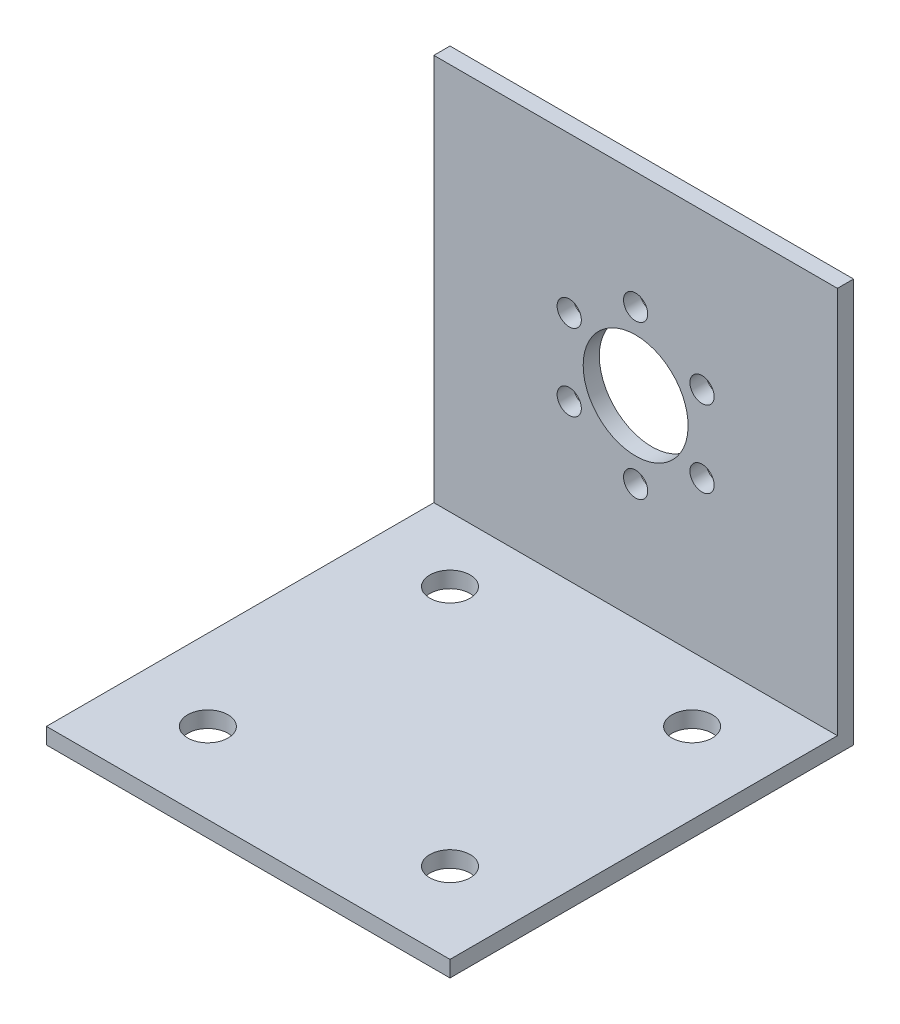
from build123d import *

# Parameters (mm, degrees)
EXTRUDE_1_DEPTH     = 50
SKETCH_3_R          = 6.5
SKETCH_3_R_2        = 1.5
CUT_EXTRUDE_1_DEPTH = 50
SKETCH_4_R          = 2.5
CUT_EXTRUDE_2_DEPTH = 50


with BuildPart() as part:
    # 草图2 → 凸台-拉伸1 (new body)
    with BuildSketch(Plane(origin=(0, 0, 0), x_dir=(0, 0, -1), z_dir=(1, 0, 0))):
        Polygon((0, 0), (50, 0), (50, 50), (48, 50), (48, 2), (0, 2), align=None)
    extrude(amount=EXTRUDE_1_DEPTH)

    # 草图3 → 切除-拉伸1 (cut)
    with BuildSketch(Plane(origin=(0, 0, -50), x_dir=(-1, 0, 0), z_dir=(0, 0, -1))):
        with Locations((-25, 26)):
            Circle(SKETCH_3_R)
        with Locations((-25, 35.5)):
            Circle(SKETCH_3_R_2)
        with Locations((-16.772758664, 30.75)):
            Circle(SKETCH_3_R_2)
        with Locations((-16.772758664, 21.25)):
            Circle(SKETCH_3_R_2)
        with Locations((-25, 16.5)):
            Circle(SKETCH_3_R_2)
        with Locations((-33.227241336, 21.25)):
            Circle(SKETCH_3_R_2)
        with Locations((-33.227241336, 30.75)):
            Circle(SKETCH_3_R_2)
    extrude(amount=-CUT_EXTRUDE_1_DEPTH, mode=Mode.SUBTRACT)

    # 草图4 → 切除-拉伸2 (cut)
    with BuildSketch(Plane.XZ):
        with Locations(Location((10, -10, 0), (0, 0, 270))):
            Circle(SKETCH_4_R)
        with Locations(Location((40, -10, 0), (0, 0, 270))):
            Circle(SKETCH_4_R)
        with Locations(Location((10, -40, 0), (0, 0, 270))):
            Circle(SKETCH_4_R)
        with Locations(Location((40, -40, 0), (0, 0, 270))):
            Circle(SKETCH_4_R)
    extrude(amount=-CUT_EXTRUDE_2_DEPTH, mode=Mode.SUBTRACT)


solid = part.part
